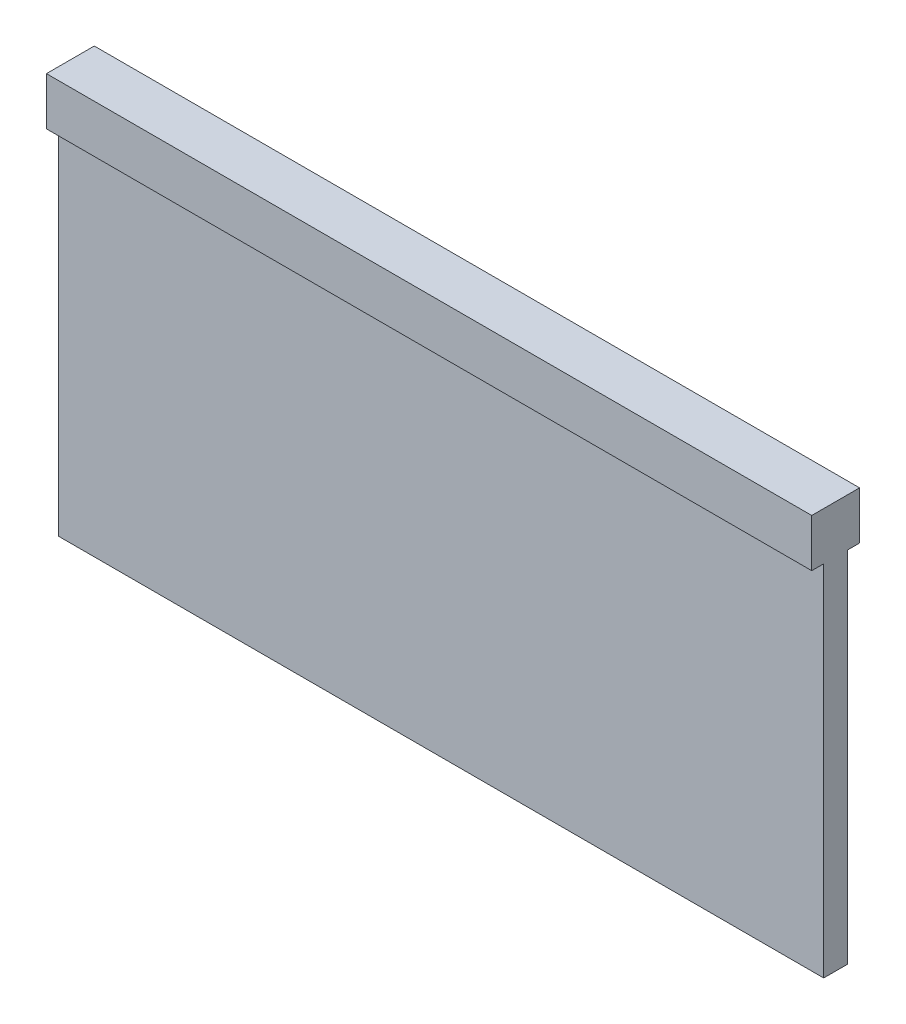
from build123d import *

# Parameters (mm, degrees)
SKETCH1_W           = 406.4
SKETCH1_H           = 215.9
BOSS_EXTRUDE1_DEPTH = 12.7
SKETCH3_W           = 406.4
SKETCH3_H           = 190.5
CUT_EXTRUDE1_DEPTH  = 6.35


with BuildPart() as part:
    # Sketch1 → Boss-Extrude1 (new, symmetric)
    with BuildSketch(Plane.XY):
        Rectangle(SKETCH1_W, SKETCH1_H)
    extrude(amount=BOSS_EXTRUDE1_DEPTH, both=True)

    # Sketch3 → Cut-Extrude1 (cut)
    with BuildSketch(Plane.XY.offset(12.7)):
        with Locations((0, -12.7)):
            Rectangle(SKETCH3_W, SKETCH3_H)
    cut_extrude1 = extrude(amount=-CUT_EXTRUDE1_DEPTH, mode=Mode.SUBTRACT)

    # Mirror1: Cut-Extrude1 across plane
    add(cut_extrude1.mirror(Plane.XY), mode=Mode.SUBTRACT)


solid = part.part
